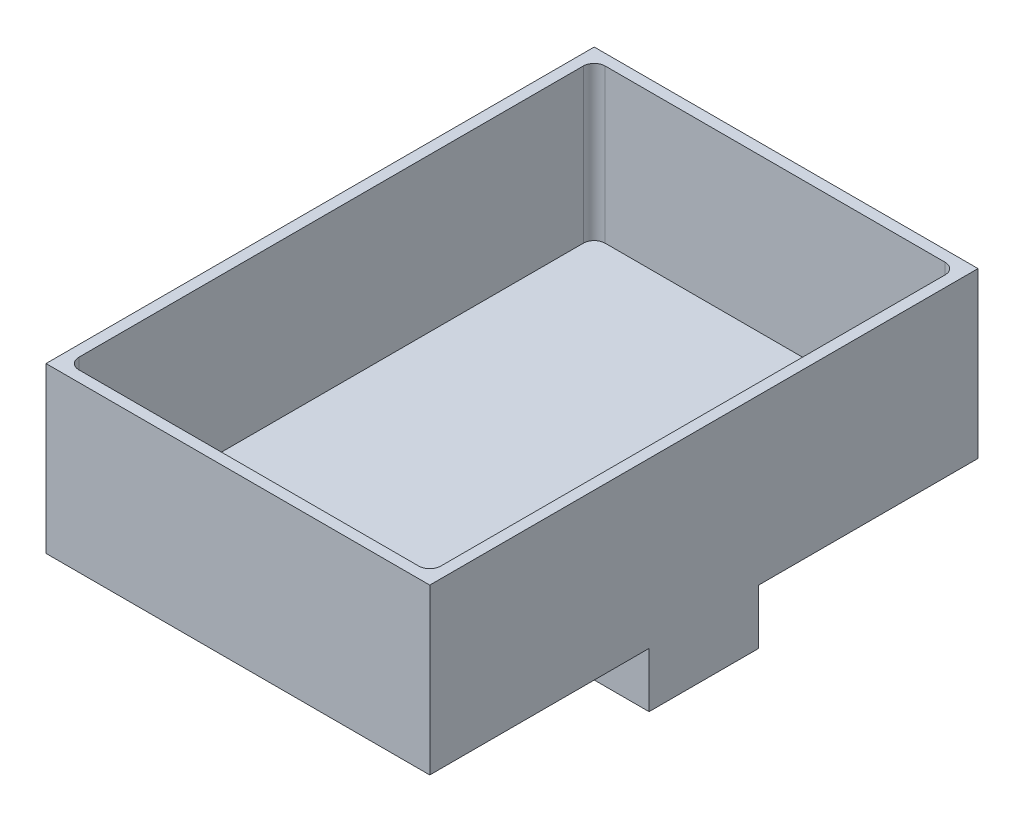
from build123d import *

# Parameters (mm, degrees)
BOSS_EXTRUDE1_DEPTH        = 70
SHELL16_T                  = -2
SHELL16_THICKNESS_2_FACE_W = 16
SHELL16_THICKNESS_2_FACE_H = 66
SHELL16_THICKNESS_2_DEPTH  = 10
FILLET1_R                  = 2


with BuildPart() as part:
    # Sketch1 → Boss-Extrude1 (new body)
    with BuildSketch(Plane(origin=(0, 0, 0), x_dir=(0, 0, -1), z_dir=(1, 0, 0))):
        Polygon((40, 0), (60, 0), (60, 10), (100, 10), (100, 40), (0, 40), (0, 10), (40, 10), align=None)
    extrude(amount=BOSS_EXTRUDE1_DEPTH)

    # Shell16
    shell16_openings = [part.faces().sort_by_distance(p)[0] for p in [
        (35, 40, -50),
    ]]
    offset(amount=SHELL16_T, openings=shell16_openings, kind=Kind.INTERSECTION)

    # Shell16 thickness 2 face (on inner face of the shell) → Shell16 thickness 2 (add)
    with BuildSketch(Plane(origin=(35, 2, -50), x_dir=(0, 0, -1), z_dir=(0, -1, 0))):
        Rectangle(SHELL16_THICKNESS_2_FACE_W, SHELL16_THICKNESS_2_FACE_H)
    extrude(amount=-SHELL16_THICKNESS_2_DEPTH)

    # Fillet1
    fillet1_edges = [part.edges().sort_by_distance(p)[0] for p in [
        (2, 26, -98),
        (2, 26, -2),
        (68, 26, -98),
        (68, 26, -2),
    ]]
    fillet(fillet1_edges, radius=FILLET1_R)


solid = part.part
